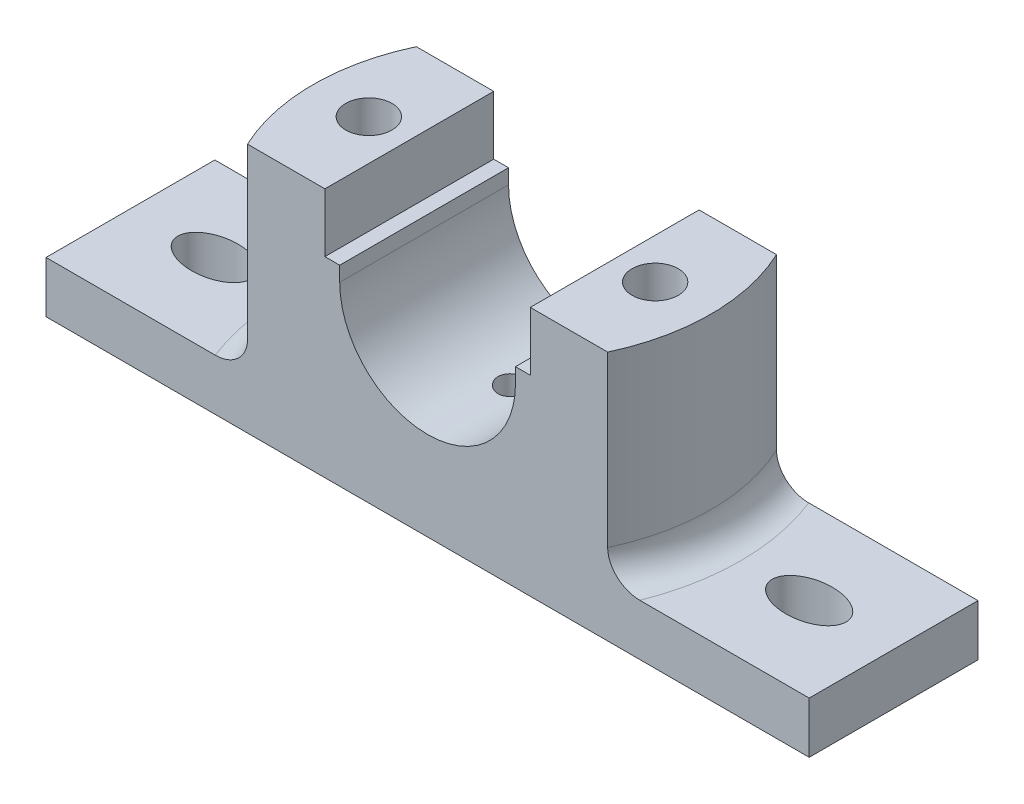
from build123d import *

# Parameters (mm, degrees)
BOSS_EXTRUDE1_DEPTH = 18.25
CUT_EXTRUDE1_START  = -43
CUT_EXTRUDE1_DEPTH  = 48
SKETCH6_R           = 5
CUT_EXTRUDE3_DEPTH  = 54.1
SKETCH7_RX          = 8
SKETCH7_RY          = 5
CUT_EXTRUDE4_DEPTH  = 11.1
FILLET3_R           = 6.4
SKETCH10_W          = 151
SKETCH10_H          = 22.5
CUT_EXTRUDE7_DEPTH  = 2.5
SKETCH11_W          = 21
SKETCH11_H          = 21
CUT_EXTRUDE8_DEPTH  = 8


with BuildPart() as part:
    # Sketch2 → Boss-Extrude1 (new, symmetric)
    with BuildSketch(Plane.XY):
        with BuildLine():
            Line((0, 0), (0, 11.1))
            Line((0, 11.1), (39.5, 11.1))
            Line((39.5, 11.1), (39.5, 54.1))
            Line((39.5, 54.1), (60.3, 54.1))
            Line((60.3, 54.1), (60.3, 41.4))
            Line((60.3, 41.4), (63.5, 41.4))
            Line((63.5, 41.4), (63.5, 38.2))
            ThreePointArc((63.5, 38.2), (69.064971157, 24.764971157), (82.5, 19.2))
            Line((82.5, 19.2), (82.5, 0))
            Line((82.5, 0), (0, 0))
        make_face()
    extrude(amount=BOSS_EXTRUDE1_DEPTH, both=True)

    # Sketch3 → Cut-Extrude1 (cut)
    with BuildSketch(Plane(origin=(0, 54.1, 0), x_dir=(1, 0, 0), z_dir=(0, 1, 0)).offset(CUT_EXTRUDE1_START)):
        with BuildLine():
            Line((39.5, -18.25), (43.564957943, -18.25))
            ThreePointArc((43.564957943, -18.25), (40.528540599, -9.348614644), (39.5, 0))
            Line((39.5, 0), (39.5, -18.25))
        make_face()
    cut_extrude1 = extrude(amount=CUT_EXTRUDE1_DEPTH, mode=Mode.SUBTRACT)

    # Mirror2: Cut-Extrude1 across plane
    add(cut_extrude1.mirror(Plane.XY), mode=Mode.SUBTRACT)

    # Mirror3: part across plane


with BuildPart() as part_1:
    add(part.part)
    add(part.part.mirror(Plane(origin=(82.5, 19.2, 18.25), x_dir=(0, 0, 1), z_dir=(1, 0, 0))))

    # Sketch6 → Cut-Extrude3 (cut)
    with BuildSketch(Plane(origin=(0, 54.1, 0), x_dir=(1, 0, 0), z_dir=(0, 1, 0))):
        with Locations(Location((51.55, 0, 0), (0, 0, 270))):
            Circle(SKETCH6_R)
    cut_extrude3 = extrude(amount=-CUT_EXTRUDE3_DEPTH, mode=Mode.SUBTRACT)

    # Sketch7 → Cut-Extrude4 (cut)
    with BuildSketch(Plane(origin=(0, 11.1, 0), x_dir=(1, 0, 0), z_dir=(0, 1, 0))):
        with Locations((18.25, 0)):
            Ellipse(SKETCH7_RX, SKETCH7_RY)
    cut_extrude4 = extrude(amount=-CUT_EXTRUDE4_DEPTH, mode=Mode.SUBTRACT)

    # Mirror4: Cut-Extrude3, Cut-Extrude4 across plane
    add(cut_extrude3.mirror(Plane.ZY.offset(-82.5)), mode=Mode.SUBTRACT)
    add(cut_extrude4.mirror(Plane.ZY.offset(-82.5)), mode=Mode.SUBTRACT)

    # Fillet3
    fillet3_edges = [part_1.edges().sort_by_distance(p)[0] for p in [
        (39.5, 11.1, 0),
        (125.5, 11.1, 0),
    ]]
    fillet(fillet3_edges, radius=FILLET3_R)

    # Sketch10 → Cut-Extrude7 (cut)
    with BuildSketch(Plane.XZ):
        with Locations((82.5, 0)):
            Rectangle(SKETCH10_W, SKETCH10_H)
    extrude(amount=-CUT_EXTRUDE7_DEPTH, mode=Mode.SUBTRACT)

    # Sketch11 → Cut-Extrude8 (cut)
    with BuildSketch(Plane.XZ):
        with Locations((51.55, 0)):
            Rectangle(SKETCH11_W, SKETCH11_H)
    cut_extrude8 = extrude(amount=-CUT_EXTRUDE8_DEPTH, mode=Mode.SUBTRACT)

    # Mirror5: Cut-Extrude8 across plane
    add(cut_extrude8.mirror(Plane.ZY.offset(-82.5)), mode=Mode.SUBTRACT)

    # Sketch12 → Cut-Revolve1 (revolve, cut)
    with BuildSketch(Plane.ZY.offset(-82.5)):
        Polygon((0, 19.5), (3, 19.5), (3, 13.5), (0, 9.983740964), align=None)
    revolve(axis=Axis((82.5, 59.1, 0), (0, -1, 0)), mode=Mode.SUBTRACT)


solid = part_1.part
